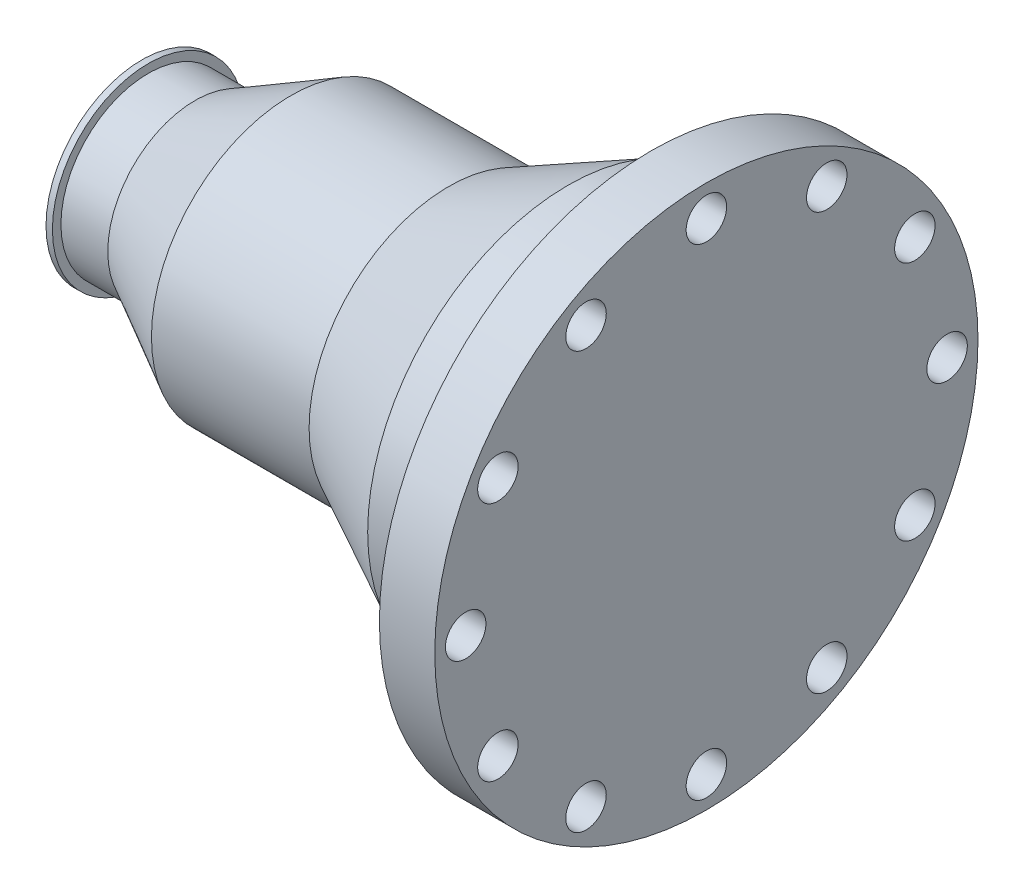
from build123d import *

# Parameters (mm, degrees)
SKETCH_3_R           = 9.5
CUT_EXTRUDE_1_DEPTH  = 321.526909947
SKETCH_4_R           = 9.5
CUT_EXTRUDE_2_DEPTH  = 321.526909947
SKETCH_5_R           = 9.5
CUT_EXTRUDE_3_DEPTH  = 321.526909947
SKETCH_6_R           = 9.5
CUT_EXTRUDE_4_DEPTH  = 321.526909947
SKETCH_7_R           = 9.5
CUT_EXTRUDE_5_DEPTH  = 321.526909947
SKETCH_8_R           = 9.5
CUT_EXTRUDE_6_DEPTH  = 321.526909947
SKETCH_9_R           = 9.5
CUT_EXTRUDE_7_DEPTH  = 321.526909947
SKETCH_10_R          = 9.5
CUT_EXTRUDE_8_DEPTH  = 321.526909947
SKETCH_11_R          = 9.5
CUT_EXTRUDE_9_DEPTH  = 321.526909947
SKETCH_12_R          = 9.5
CUT_EXTRUDE_10_DEPTH = 321.526909947
SKETCH_13_R          = 9.5
CUT_EXTRUDE_11_DEPTH = 321.526909947
SKETCH_14_R          = 9.5
CUT_EXTRUDE_12_DEPTH = 321.526909947


with BuildPart() as part:
    # Эскиз1 → Повернуть1 (revolve)
    with BuildSketch(Plane.XY, mode=Mode.PRIVATE) as revolve_1_sk:
        Polygon((0, 0), (265, 0), (265, 127.5), (239, 127.5), (239, 100), (239, 95), (220, 95), (220, 94), (200, 94), (144, 65.5), (70, 65.5), (25, 41), (3, 41), (3, 45), (0, 45), align=None)
    revolve(revolve_1_sk.sketch.rotate(Axis((0, 0, 0), (1, 0, 0)), 90), axis=Axis((0, 0, 0), (1, 0, 0)))

    # Эскиз2 → Вырез-Повернуть1 (revolve, cut)
    with BuildSketch(Plane.XY, mode=Mode.PRIVATE) as cut_revolve_1_sk:
        with BuildLine():
            Line((0, 0), (239, 0))
            Line((239, 0), (239, 47))
            Line((239, 47), (210, 47))
            ThreePointArc((210, 47), (209, 47.16088641), (208, 47))
            Line((208, 47), (200, 55))
            Line((200, 55), (147.669872, 55))
            ThreePointArc((147.669872, 55), (146.273624348, 54.108499061), (146.669872, 52.5))
            Line((146.669872, 52.5), (143.5, 52.5))
            ThreePointArc((143.5, 52.5), (142.75, 52.602347572), (142, 52.5))
            Line((142, 52.5), (90, 52.5))
            ThreePointArc((90, 52.5), (79.13262933, 46.740617582), (70, 38.502577))
            Line((70, 38.502577), (42, 31))
            Line((42, 31), (0, 31))
            Line((0, 31), (0, 0))
        make_face()
    revolve(cut_revolve_1_sk.sketch.rotate(Axis((0, 0, 0), (1, 0, 0)), 90), axis=Axis((0, 0, 0), (1, 0, 0)), mode=Mode.SUBTRACT)

    # Эскиз3 → Вырез-Вытянуть1 (cut, through all)
    with BuildSketch(Plane(origin=(0, 0, 0), x_dir=(0, 0, -1), z_dir=(1, 0, 0))):
        with Locations((0, 113)):
            Circle(SKETCH_3_R)
    extrude(amount=CUT_EXTRUDE_1_DEPTH, mode=Mode.SUBTRACT)

    # Эскиз4 → Вырез-Вытянуть2 (cut, through all)
    with BuildSketch(Plane(origin=(0, 0, 0), x_dir=(0, 0, -1), z_dir=(1, 0, 0))):
        with Locations((-56.5, 97.860870628)):
            Circle(SKETCH_4_R)
    extrude(amount=CUT_EXTRUDE_2_DEPTH, mode=Mode.SUBTRACT)

    # Эскиз5 → Вырез-Вытянуть3 (cut, through all)
    with BuildSketch(Plane(origin=(0, 0, 0), x_dir=(0, 0, -1), z_dir=(1, 0, 0))):
        with Locations((-97.860870628, 56.5)):
            Circle(SKETCH_5_R)
    extrude(amount=CUT_EXTRUDE_3_DEPTH, mode=Mode.SUBTRACT)

    # Эскиз6 → Вырез-Вытянуть4 (cut, through all)
    with BuildSketch(Plane(origin=(0, 0, 0), x_dir=(0, 0, -1), z_dir=(1, 0, 0))):
        with Locations((-113, 0)):
            Circle(SKETCH_6_R)
    extrude(amount=CUT_EXTRUDE_4_DEPTH, mode=Mode.SUBTRACT)

    # Эскиз7 → Вырез-Вытянуть5 (cut, through all)
    with BuildSketch(Plane(origin=(0, 0, 0), x_dir=(0, 0, -1), z_dir=(1, 0, 0))):
        with Locations((-97.860870628, -56.5)):
            Circle(SKETCH_7_R)
    extrude(amount=CUT_EXTRUDE_5_DEPTH, mode=Mode.SUBTRACT)

    # Эскиз8 → Вырез-Вытянуть6 (cut, through all)
    with BuildSketch(Plane(origin=(0, 0, 0), x_dir=(0, 0, -1), z_dir=(1, 0, 0))):
        with Locations((-56.5, -97.860870628)):
            Circle(SKETCH_8_R)
    extrude(amount=CUT_EXTRUDE_6_DEPTH, mode=Mode.SUBTRACT)

    # Эскиз9 → Вырез-Вытянуть7 (cut, through all)
    with BuildSketch(Plane(origin=(0, 0, 0), x_dir=(0, 0, -1), z_dir=(1, 0, 0))):
        with Locations((0, -113)):
            Circle(SKETCH_9_R)
    extrude(amount=CUT_EXTRUDE_7_DEPTH, mode=Mode.SUBTRACT)

    # Эскиз10 → Вырез-Вытянуть8 (cut, through all)
    with BuildSketch(Plane(origin=(0, 0, 0), x_dir=(0, 0, -1), z_dir=(1, 0, 0))):
        with Locations((56.5, -97.860870628)):
            Circle(SKETCH_10_R)
    extrude(amount=CUT_EXTRUDE_8_DEPTH, mode=Mode.SUBTRACT)

    # Эскиз11 → Вырез-Вытянуть9 (cut, through all)
    with BuildSketch(Plane(origin=(0, 0, 0), x_dir=(0, 0, -1), z_dir=(1, 0, 0))):
        with Locations((97.860870628, -56.5)):
            Circle(SKETCH_11_R)
    extrude(amount=CUT_EXTRUDE_9_DEPTH, mode=Mode.SUBTRACT)

    # Эскиз12 → Вырез-Вытянуть10 (cut, through all)
    with BuildSketch(Plane(origin=(0, 0, 0), x_dir=(0, 0, -1), z_dir=(1, 0, 0))):
        with Locations((113, 0)):
            Circle(SKETCH_12_R)
    extrude(amount=CUT_EXTRUDE_10_DEPTH, mode=Mode.SUBTRACT)

    # Эскиз13 → Вырез-Вытянуть11 (cut, through all)
    with BuildSketch(Plane(origin=(0, 0, 0), x_dir=(0, 0, -1), z_dir=(1, 0, 0))):
        with Locations((97.860870628, 56.5)):
            Circle(SKETCH_13_R)
    extrude(amount=CUT_EXTRUDE_11_DEPTH, mode=Mode.SUBTRACT)

    # Эскиз14 → Вырез-Вытянуть12 (cut, through all)
    with BuildSketch(Plane(origin=(0, 0, 0), x_dir=(0, 0, -1), z_dir=(1, 0, 0))):
        with Locations((56.5, 97.860870628)):
            Circle(SKETCH_14_R)
    extrude(amount=CUT_EXTRUDE_12_DEPTH, mode=Mode.SUBTRACT)


solid = part.part
